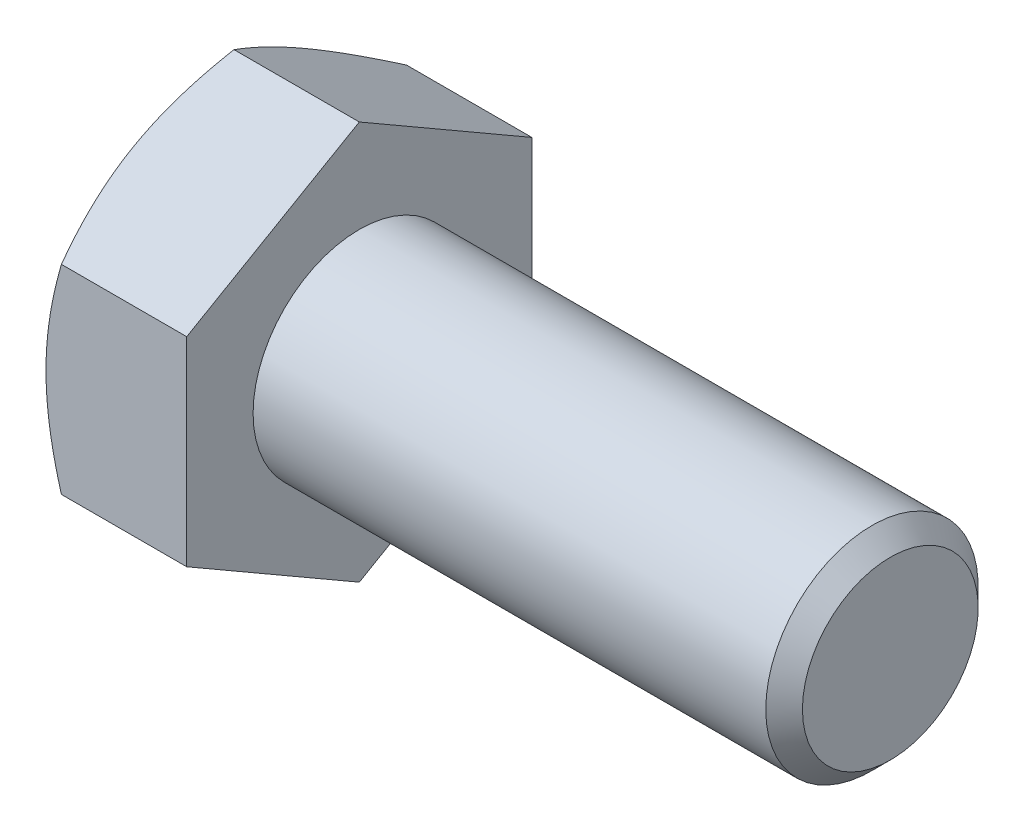
from build123d import *

# Parameters (mm, degrees)
BASEHEAD_DEPTH = 5.3


with BuildPart() as part:
    # Sketch1 → BaseHead (new body)
    with BuildSketch(Plane(origin=(0, 0, 0), x_dir=(0, 0, -1), z_dir=(1, 0, 0))):
        Polygon((6.5, 3.75277675), (6.5, -3.75277675), (0, -7.505553499), (-6.5, -3.75277675), (-6.5, 3.75277675), (0, 7.505553499), align=None)
    extrude(amount=BASEHEAD_DEPTH)

    # BodySke → BaseBody (revolve)
    with BuildSketch(Plane.XY, mode=Mode.PRIVATE) as basebody_sk:
        Polygon((0, 0), (25.3, 0), (25.3, 3.3095), (24.6095, 4), (0, 4), align=None)
    revolve(basebody_sk.sketch.rotate(Axis((0, 0, 0), (1, 0, 0)), 90), axis=Axis((0, 0, 0), (1, 0, 0)))

    # Sketch3 → HeadChamfer (revolve, cut)
    with BuildSketch(Plane.XY):
        Polygon((0, 6.5), (3.46730793, 12.505553499), (3.46730793, 17.505553499), (-10, 17.505553499), (-10, 6.5), align=None)
    revolve(axis=Axis((0, 0, 0), (1, 0, 0)), mode=Mode.SUBTRACT)


solid = part.part
